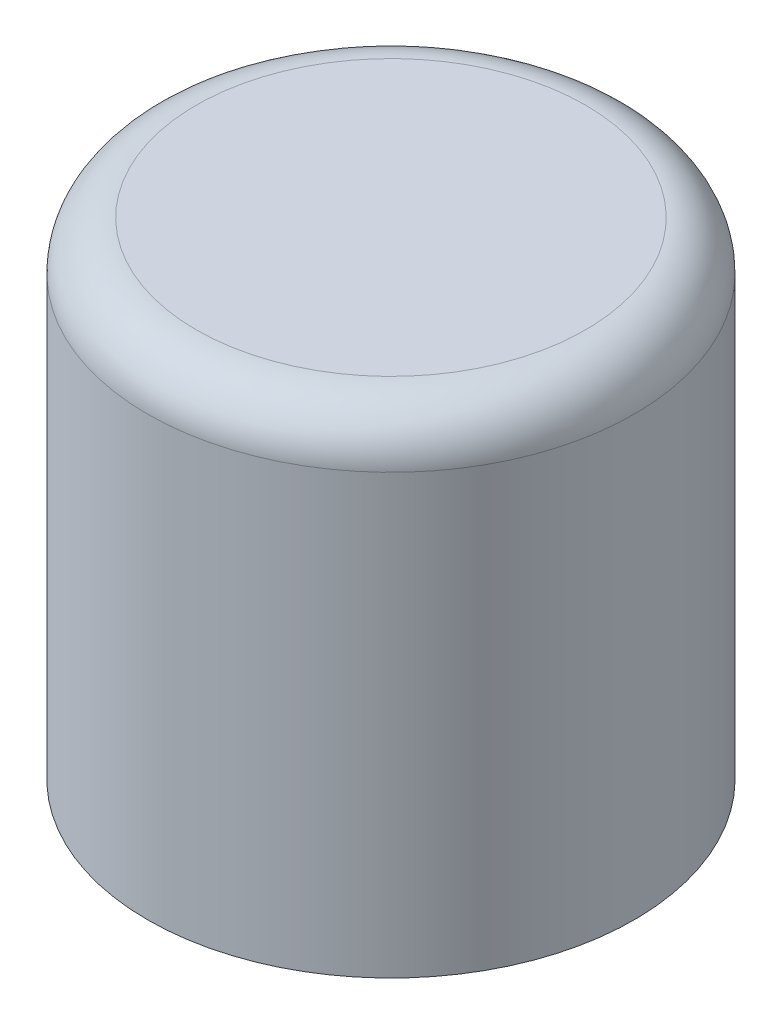
from build123d import *

# Parameters (mm, degrees)
SKETCH1_R           = 10.16
BOSS_EXTRUDE1_DEPTH = 20.32
FILLET1_R           = 2.032


with BuildPart() as part:
    # Sketch1 → Boss-Extrude1 (new body)
    with BuildSketch(Plane(origin=(0, 0, 0), x_dir=(1, 0, 0), z_dir=(0, 1, 0))):
        with Locations(Location((0, 0, 0), (0, 0, 270))):
            Circle(SKETCH1_R)
    extrude(amount=BOSS_EXTRUDE1_DEPTH)

    # Fillet1
    fillet1_edges = [part.edges().sort_by_distance(p)[0] for p in [
        (0, 20.32, -10.16),
    ]]
    fillet(fillet1_edges, radius=FILLET1_R)


solid = part.part
